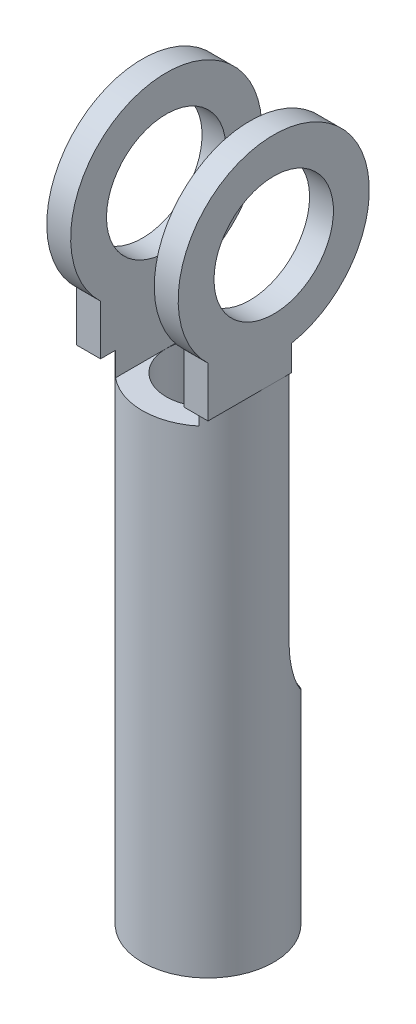
from build123d import *
from build123d.topology import SkipClean

# Parameters (mm, degrees)
SKETCH_1_R               = 2.75
SKETCH_1_R_2             = 1.75
EXTRUDE_1_DEPTH          = 20
CUT_EXTRUDE_2_DEPTH      = 21.374616561
CUT_EXTRUDE_2_DEPTH_BACK = 21.374616561
SKETCH_3_W               = 1
SKETCH_3_H               = 8
EXTRUDE_3_DEPTH          = 10
SKETCH_4_R               = 2.5
CUT_EXTRUDE_5_DEPTH      = 31.761176848
CUT_EXTRUDE_8_DEPTH      = 1


with BuildPart() as part:
    # 草圖1 → 伸長1 (new body)
    with BuildSketch(Plane(origin=(0, 0, 0), x_dir=(1, 0, 0), z_dir=(0, 1, 0))):
        with Locations(Location((0, 0, 0), (0, 0, 270))):
            Circle(SKETCH_1_R)
        with Locations(Location((0, 0, 0), (0, 0, 270))):
            Circle(SKETCH_1_R_2, mode=Mode.SUBTRACT)
    extrude(amount=EXTRUDE_1_DEPTH)

    # 草圖2 → 伸長2 (cut, two sides: drawn at the far end of the back side and taken through both)
    with BuildSketch(Plane(origin=(0, 0, 0), x_dir=(0, 0, -1), z_dir=(1, 0, 0)).offset(-CUT_EXTRUDE_2_DEPTH_BACK)):
        with BuildLine():
            Line((0.75, 20), (0.75, 11.16227766))
            ThreePointArc((0.75, 11.16227766), (1.291960108, 9.291448967), (2.75, 8))
            Line((2.75, 8), (2.75, 20))
            Line((2.75, 20), (0.75, 20))
        make_face()
    extrude(amount=CUT_EXTRUDE_2_DEPTH + CUT_EXTRUDE_2_DEPTH_BACK, mode=Mode.SUBTRACT)

    # 草圖3 → 伸長3 (add)
    with BuildSketch(Plane(origin=(0, 20, 0), x_dir=(1, 0, 0), z_dir=(0, 1, 0))):
        with Locations((-2.25, 0)):
            Rectangle(SKETCH_3_W, SKETCH_3_H)
        with Locations((2.25, 0)):
            Rectangle(SKETCH_3_W, SKETCH_3_H)
    extrude(amount=EXTRUDE_3_DEPTH)

    # 草圖4 → 伸長5 (cut, through all)
    with BuildSketch(Plane.ZY.offset(2.75)):
        with BuildLine():
            Line((-4, 20), (-0.75, 20))
            Line((-0.75, 20), (-0.75, 22.070941589))
            ThreePointArc((-0.75, 22.070941589), (-3.082207, 23.450490242), (-4, 25.999999996))
            Line((-4, 25.999999996), (-4, 20))
        make_face()
        with BuildLine():
            Line((4, 20), (4, 26))
            ThreePointArc((4, 26), (3.674234614, 24.41886117), (2.75, 23.09526249))
            Line((2.75, 23.09526249), (2.75, 20))
            Line((2.75, 20), (4, 20))
        make_face()
        with BuildLine():
            Line((4, 30), (0, 30))
            ThreePointArc((0, 30), (2.828427125, 28.828427125), (4, 26))
            Line((4, 26), (4, 30))
        make_face()
        with BuildLine():
            Line((-4, 30), (-4, 25.999999996))
            ThreePointArc((-4, 25.999999996), (-2.828427126, 28.828427123), (0, 30))
            Line((0, 30), (-4, 30))
        make_face()
        with Locations((0, 26)):
            Circle(SKETCH_4_R)
    extrude(amount=-CUT_EXTRUDE_5_DEPTH, mode=Mode.SUBTRACT)

    # 草圖10 → 伸長8 (cut)
    with SkipClean():  # the faces are left unmerged after this step: merging them gives an invalid solid
        with BuildSketch(Plane.XZ.offset(-20)):
            with BuildLine():
                Line((0, 2.75), (-2.75, 2.75))
                Line((-2.75, 2.75), (-2.75, 0))
                ThreePointArc((-2.75, 0), (-1.944543648, 1.944543648), (0, 2.75))
            make_face()
            with BuildLine():
                Line((2.75, 0), (2.75, 2.75))
                Line((2.75, 2.75), (1.75, 2.75))
                Line((1.75, 2.75), (1.75, 2.121320344))
                ThreePointArc((1.75, 2.121320344), (2.487468593, 1.17260394), (2.75, 0))
            make_face()
            with BuildLine():
                Line((1.75, 2.75), (0, 2.75))
                ThreePointArc((0, 2.75), (0.929749712, 2.588062108), (1.75, 2.121320344))
                Line((1.75, 2.121320344), (1.75, 2.75))
            make_face()
            with BuildLine():
                ThreePointArc((-2.645751311, -0.75), (-2.723813146, -0.378605266), (-2.75, 0))
                Line((-2.75, 0), (-2.75, -0.75))
                Line((-2.75, -0.75), (-2.645751311, -0.75))
            make_face()
            with BuildLine():
                Line((2.75, -0.75), (2.75, 0))
                ThreePointArc((2.75, 0), (2.723813146, -0.378605266), (2.645751311, -0.75))
                Line((2.645751311, -0.75), (2.75, -0.75))
            make_face()
        extrude(amount=-CUT_EXTRUDE_8_DEPTH, mode=Mode.SUBTRACT)


solid = part.part
